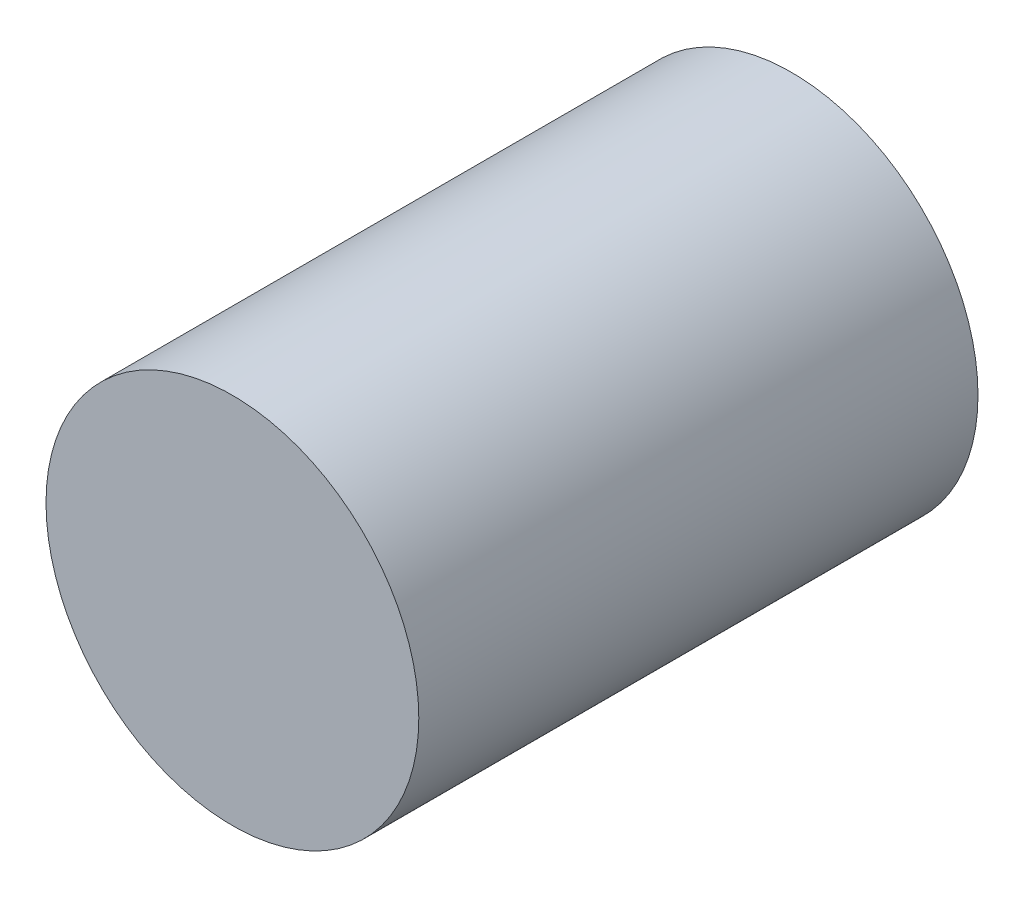
from build123d import *

# Parameters (mm, degrees)
SKETCH1_R           = 10
BOSS_EXTRUDE1_DEPTH = 30


with BuildPart() as part:
    # Sketch1 → Boss-Extrude1 (new body)
    with BuildSketch(Plane.XY):
        Circle(SKETCH1_R)
    extrude(amount=BOSS_EXTRUDE1_DEPTH)


solid = part.part
